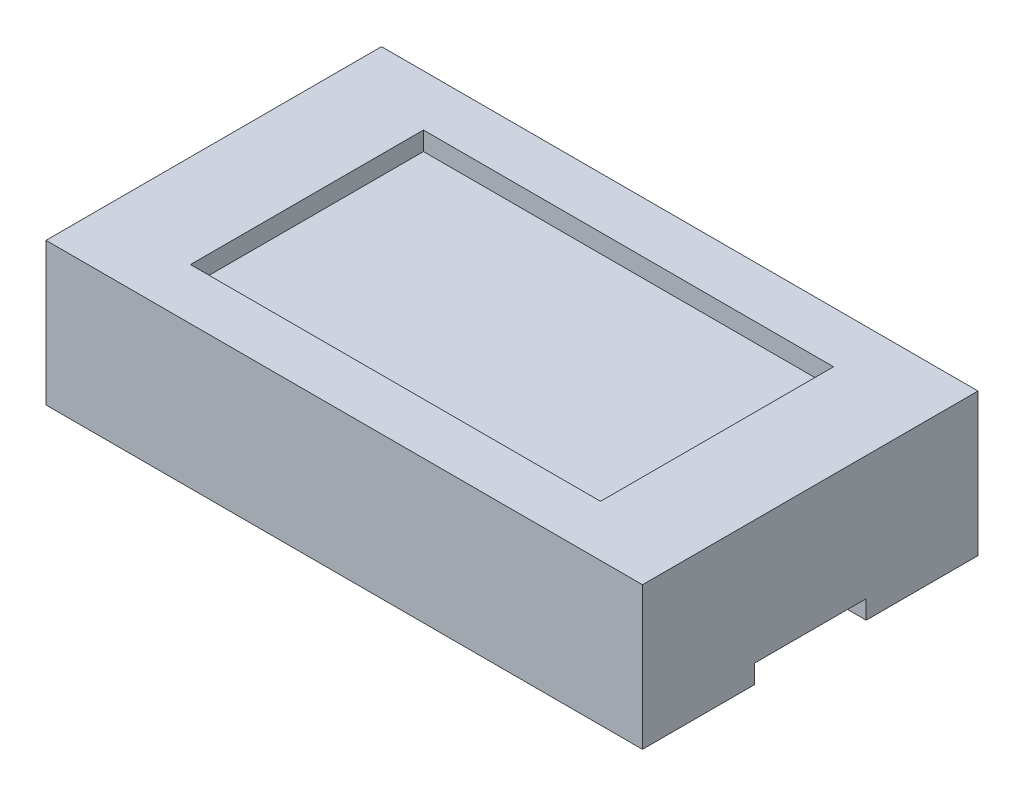
from build123d import *

# Parameters (mm, degrees)
SKETCH_1_W          = 64
SKETCH_1_H          = 36
EXTRUDE_1_DEPTH     = 15.3
SKETCH_2_W          = 44
SKETCH_2_H          = 25
CUT_EXTRUDE_1_DEPTH = 2
SKETCH_3_W          = 16
SKETCH_3_H          = 6
CUT_EXTRUDE_2_DEPTH = 2


with BuildPart() as part:
    # 草图1 → 凸台-拉伸1 (new body)
    with BuildSketch(Plane(origin=(0, 0, 0), x_dir=(1, 0, 0), z_dir=(0, 1, 0))):
        Rectangle(SKETCH_1_W, SKETCH_1_H)
    extrude(amount=EXTRUDE_1_DEPTH)

    # 草图2 → 切除-拉伸1 (cut)
    with BuildSketch(Plane(origin=(0, 15.3, 0), x_dir=(1, 0, 0), z_dir=(0, 1, 0))):
        Rectangle(SKETCH_2_W, SKETCH_2_H)
    extrude(amount=-CUT_EXTRUDE_1_DEPTH, mode=Mode.SUBTRACT)

    # 草图3 → 切除-拉伸2 (cut)
    with BuildSketch(Plane.XZ):
        with Locations((24, -3)):
            Rectangle(SKETCH_3_W, SKETCH_3_H)
        with Locations((24, 3)):
            Rectangle(SKETCH_3_W, SKETCH_3_H)
    extrude(amount=-CUT_EXTRUDE_2_DEPTH, mode=Mode.SUBTRACT)


solid = part.part
